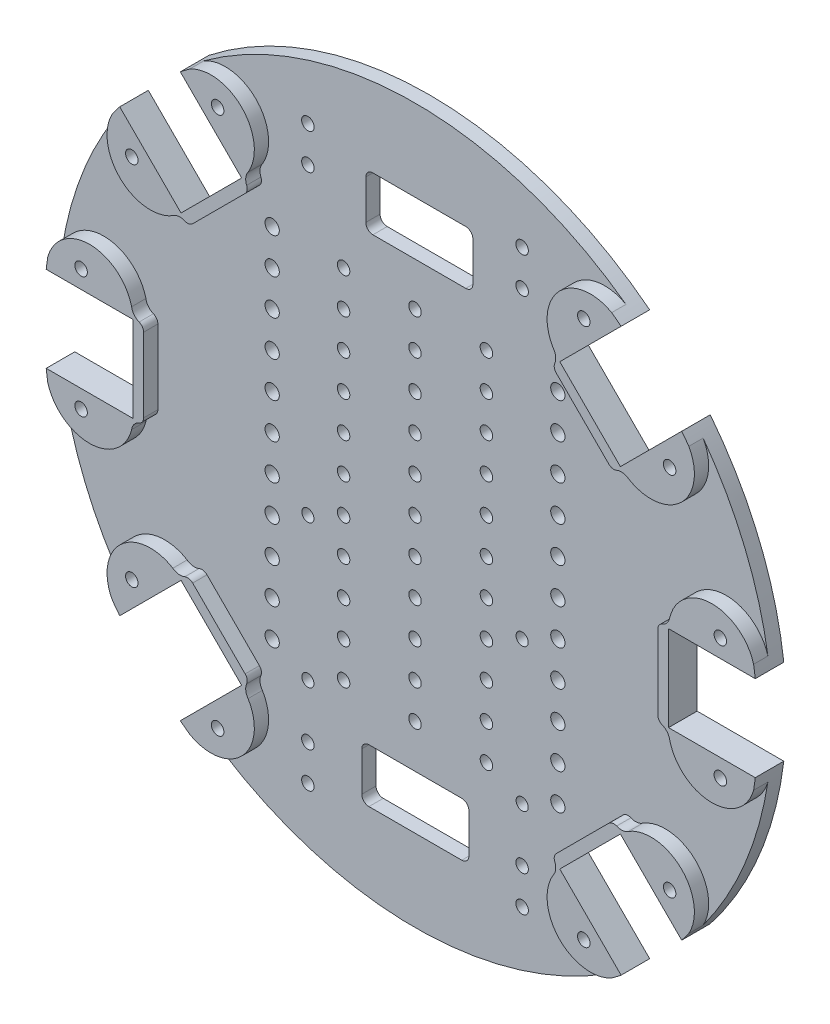
from build123d import *

# Parameters (mm, degrees)
SKETCH1_R           = 1.75
BOSS_EXTRUDE1_DEPTH = 4
SKETCH2_R           = 1.75
SKETCH2_R_2         = 2
SKETCH2_R_3         = 1.7
CUT_EXTRUDE1_DEPTH  = 10
SKETCH3_R           = 1.75
BOSS_EXTRUDE2_DEPTH = 4
CUT_EXTRUDE2_DEPTH  = 10


with BuildPart() as part:
    # Sketch1 → Boss-Extrude1 (new body)
    with BuildSketch(Plane.XY):
        with BuildLine():
            Line((61.518289963, 44.547727215), (44.547727215, 61.518289963))
            Line((44.547727215, 61.518289963), (61.714433725, 78.684996473))
            ThreePointArc((61.714433725, 78.684996473), (0, 100), (-61.714433725, 78.684996473))
            Line((-61.714433725, 78.684996473), (-44.547727215, 61.518289963))
            Line((-44.547727215, 61.518289963), (-61.518289963, 44.547727215))
            Line((-61.518289963, 44.547727215), (-78.684996473, 61.714433725))
            ThreePointArc((-78.684996473, 61.714433725), (-92.387953251, 38.268343237), (-99.277389168, 12))
            Line((-99.277389168, 12), (-75, 12))
            Line((-75, 12), (-75, -12))
            Line((-75, -12), (-99.277389168, -12))
            ThreePointArc((-99.277389168, -12), (-92.387953251, -38.268343237), (-78.684996473, -61.714433725))
            Line((-78.684996473, -61.714433725), (-61.518289963, -44.547727215))
            Line((-61.518289963, -44.547727215), (-44.547727215, -61.518289963))
            Line((-44.547727215, -61.518289963), (-61.714433725, -78.684996473))
            ThreePointArc((-61.714433725, -78.684996473), (0, -100), (61.714433725, -78.684996473))
            Line((61.714433725, -78.684996473), (44.547727215, -61.518289963))
            Line((44.547727215, -61.518289963), (61.518289963, -44.547727215))
            Line((61.518289963, -44.547727215), (78.684996473, -61.714433725))
            ThreePointArc((78.684996473, -61.714433725), (92.387953251, -38.268343237), (99.277389168, -12))
            Line((99.277389168, -12), (75, -12))
            Line((75, -12), (75, 12))
            Line((75, 12), (99.277389168, 12))
            ThreePointArc((99.277389168, 12), (92.387953251, 38.268343237), (78.684996473, 61.714433725))
            Line((78.684996473, 61.714433725), (61.518289963, 44.547727215))
        make_face()
        with Locations((-51.265241636, -75.306872196)):
            Circle(SKETCH1_R, mode=Mode.SUBTRACT)
        with Locations((-75.306872196, -51.265241636)):
            Circle(SKETCH1_R, mode=Mode.SUBTRACT)
        with Locations((-89.5, -17)):
            Circle(SKETCH1_R, mode=Mode.SUBTRACT)
        with Locations((51.265241636, -75.306872196)):
            Circle(SKETCH1_R, mode=Mode.SUBTRACT)
        with Locations((75.306872196, -51.265241636)):
            Circle(SKETCH1_R, mode=Mode.SUBTRACT)
        with Locations((89.5, -17)):
            Circle(SKETCH1_R, mode=Mode.SUBTRACT)
        with Locations((-89.5, 17)):
            Circle(SKETCH1_R, mode=Mode.SUBTRACT)
        with Locations((-75.306872196, 51.265241636)):
            Circle(SKETCH1_R, mode=Mode.SUBTRACT)
        with Locations((-51.265241636, 75.306872196)):
            Circle(SKETCH1_R, mode=Mode.SUBTRACT)
        with Locations((89.5, 17)):
            Circle(SKETCH1_R, mode=Mode.SUBTRACT)
        with Locations((75.306872196, 51.265241636)):
            Circle(SKETCH1_R, mode=Mode.SUBTRACT)
        with Locations((51.265241636, 75.306872196)):
            Circle(SKETCH1_R, mode=Mode.SUBTRACT)
    extrude(amount=BOSS_EXTRUDE1_DEPTH)

    # Sketch2 → Cut-Extrude1 (cut)
    with BuildSketch(Plane.XY.offset(4)):
        with Locations((0, 40)):
            Circle(SKETCH2_R)
        with Locations((-40, 40)):
            Circle(SKETCH2_R_2)
        with Locations((-20, 40)):
            Circle(SKETCH2_R)
        with Locations((-40, 50)):
            Circle(SKETCH2_R_2)
        with Locations((-20, 50)):
            Circle(SKETCH2_R)
        with Locations((-30, 70)):
            Circle(SKETCH2_R)
        with Locations((-30, 80)):
            Circle(SKETCH2_R)
        with Locations((30, 80)):
            Circle(SKETCH2_R)
        with Locations((30, 70)):
            Circle(SKETCH2_R)
        with Locations((40, 50)):
            Circle(SKETCH2_R_2)
        with Locations((20, 50)):
            Circle(SKETCH2_R)
        with Locations((0, 50)):
            Circle(SKETCH2_R)
        with Locations((40, 40)):
            Circle(SKETCH2_R_2)
        with Locations((20, 40)):
            Circle(SKETCH2_R)
        with Locations((30, -80)):
            Circle(SKETCH2_R)
        with Locations((-30, -80)):
            Circle(SKETCH2_R)
        with Locations((30, -70)):
            Circle(SKETCH2_R)
        with Locations((-30, -70)):
            Circle(SKETCH2_R)
        with Locations((0, 10)):
            Circle(SKETCH2_R)
        with Locations((-40, 10)):
            Circle(SKETCH2_R_2)
        with Locations((-20, 10)):
            Circle(SKETCH2_R)
        with Locations((40, 10)):
            Circle(SKETCH2_R_2)
        with Locations((20, 10)):
            Circle(SKETCH2_R)
        with Locations((0, 20)):
            Circle(SKETCH2_R)
        with Locations((-40, 20)):
            Circle(SKETCH2_R_2)
        with Locations((-20, 20)):
            Circle(SKETCH2_R)
        with Locations((40, 20)):
            Circle(SKETCH2_R_2)
        with Locations((20, 20)):
            Circle(SKETCH2_R)
        with Locations((0, 30)):
            Circle(SKETCH2_R)
        with Locations((-40, 30)):
            Circle(SKETCH2_R_2)
        with Locations((-20, 30)):
            Circle(SKETCH2_R)
        with Locations((40, 30)):
            Circle(SKETCH2_R_2)
        with Locations((20, 30)):
            Circle(SKETCH2_R)
        with Locations((0, -10)):
            Circle(SKETCH2_R)
        with Locations((40, -10)):
            Circle(SKETCH2_R_2)
        with Locations((20, -10)):
            Circle(SKETCH2_R)
        with Locations((-40, -10)):
            Circle(SKETCH2_R_2)
        with Locations((-20, -10)):
            Circle(SKETCH2_R)
        with Locations((0, -20)):
            Circle(SKETCH2_R)
        with Locations((40, -20)):
            Circle(SKETCH2_R_2)
        with Locations((20, -20)):
            Circle(SKETCH2_R)
        with Locations((-40, -20)):
            Circle(SKETCH2_R_2)
        with Locations((-20, -20)):
            Circle(SKETCH2_R)
        with Locations((0, -30)):
            Circle(SKETCH2_R)
        with Locations((40, -30)):
            Circle(SKETCH2_R_2)
        with Locations((20, -30)):
            Circle(SKETCH2_R)
        with Locations((-40, -30)):
            Circle(SKETCH2_R_2)
        with Locations((-20, -30)):
            Circle(SKETCH2_R)
        with Locations((0, -40)):
            Circle(SKETCH2_R)
        with Locations((40, -40)):
            Circle(SKETCH2_R_2)
        with Locations((20, -40)):
            Circle(SKETCH2_R)
        with Locations((-40, -40)):
            Circle(SKETCH2_R_2)
        with Locations((-20, -40)):
            Circle(SKETCH2_R)
        with Locations((0, -50)):
            Circle(SKETCH2_R)
        with Locations((40, -50)):
            Circle(SKETCH2_R_2)
        with Locations((20, -50)):
            Circle(SKETCH2_R)
        with Locations((-40, -50)):
            Circle(SKETCH2_R_2)
        with Locations((-20, -50)):
            Circle(SKETCH2_R)
        with Locations((-30, -55)):
            Circle(SKETCH2_R_3)
        with Locations((-30, -15)):
            Circle(SKETCH2_R_3)
        with Locations((30, -55)):
            Circle(SKETCH2_R_3)
        with Locations((30, -15)):
            Circle(SKETCH2_R_3)
        with Locations((-40, 0)):
            Circle(SKETCH2_R_2)
        with Locations((-20, 0)):
            Circle(SKETCH2_R)
        Circle(SKETCH2_R)
        with Locations((40, 0)):
            Circle(SKETCH2_R_2)
        with Locations((20, 0)):
            Circle(SKETCH2_R)
    extrude(amount=-CUT_EXTRUDE1_DEPTH, mode=Mode.SUBTRACT)

    # Sketch3 → Boss-Extrude2 (add)
    # profile 1 of 19: a face of its own
    with BuildSketch(Plane.XY.offset(4)):
        with BuildLine():
            ThreePointArc((42.745208303, -63.818207412), (44.40985161, -78.544869697), (59.074881311, -80.685552598))
            ThreePointArc((59.074881311, -80.685552598), (60.402940433, -79.696203091), (61.714433725, -78.684996473))
            Line((61.714433725, -78.684996473), (44.547727215, -61.518289963))
            ThreePointArc((44.547727215, -61.518289963), (43.738044879, -62.41276888), (43.021158129, -63.383207651))
            ThreePointArc((43.021158129, -63.383207651), (42.89146595, -63.605961831), (42.745208303, -63.818207412))
        make_face()
        with Locations((51.265241636, -75.306872196)):
            Circle(SKETCH3_R, mode=Mode.SUBTRACT)
    # profile 2 of 19: a face of its own
    with BuildSketch(Plane.XY.offset(4)):
        with BuildLine():
            ThreePointArc((43.021158129, -63.383207651), (43.738044879, -62.41276888), (44.547727215, -61.518289963))
            Line((44.547727215, -61.518289963), (61.518289963, -44.547727215))
            ThreePointArc((61.518289963, -44.547727215), (62.41276888, -43.738044879), (63.383207651, -43.021158129))
            ThreePointArc((63.383207651, -43.021158129), (61.934255267, -43.415364041), (60.457290906, -43.144370333))
            ThreePointArc((60.457290906, -43.144370333), (59.291136488, -43.01863263), (58.255022397, -43.568354094))
            Line((58.255022397, -43.568354094), (43.568354094, -58.255022397))
            ThreePointArc((43.568354094, -58.255022397), (43.01863263, -59.291136488), (43.144370333, -60.457290906))
            ThreePointArc((43.144370333, -60.457290906), (43.415364041, -61.934255267), (43.021158129, -63.383207651))
        make_face()
    # profile 3 of 19: a face of its own
    with BuildSketch(Plane.XY.offset(4)):
        with BuildLine():
            ThreePointArc((78.684996473, -61.714433725), (79.696203091, -60.402940433), (80.685552598, -59.074881311))
            ThreePointArc((80.685552598, -59.074881311), (78.544869697, -44.40985161), (63.818207412, -42.745208303))
            ThreePointArc((63.818207412, -42.745208303), (63.605961831, -42.89146595), (63.383207651, -43.021158129))
            ThreePointArc((63.383207651, -43.021158129), (62.41276888, -43.738044879), (61.518289963, -44.547727215))
            Line((61.518289963, -44.547727215), (78.684996473, -61.714433725))
        make_face()
        with Locations((75.306872196, -51.265241636)):
            Circle(SKETCH3_R, mode=Mode.SUBTRACT)
    # profile 4 of 19: a face of its own
    with BuildSketch(Plane.XY.offset(4)):
        with BuildLine():
            Line((99.277389168, -12), (75, -12))
            ThreePointArc((75, -12), (75.059960237, -13.205023978), (75.239248591, -14.398143296))
            ThreePointArc((75.239248591, -14.398143296), (75.305053363, -14.647360506), (75.351713878, -14.90086057))
            ThreePointArc((75.351713878, -14.90086057), (86.942117215, -24.137102766), (98.825550559, -15.281052213))
            ThreePointArc((98.825550559, -15.281052213), (99.065054424, -13.642396857), (99.277389168, -12))
        make_face()
        with Locations((89.5, -17)):
            Circle(SKETCH3_R, mode=Mode.SUBTRACT)
    # profile 5 of 19: a face of its own
    with BuildSketch(Plane.XY.offset(4)):
        with BuildLine():
            Line((75, -12), (75, 12))
            ThreePointArc((75, 12), (75.059960237, 13.205023978), (75.239248591, 14.398143296))
            ThreePointArc((75.239248591, 14.398143296), (74.493430208, 13.094833565), (73.257437204, 12.242083539))
            ThreePointArc((73.257437204, 12.242083539), (72.343931524, 11.506397825), (72, 10.38504275))
            Line((72, 10.38504275), (72, -10.38504275))
            ThreePointArc((72, -10.38504275), (72.343931524, -11.506397825), (73.257437204, -12.242083539))
            ThreePointArc((73.257437204, -12.242083539), (74.493430208, -13.094833565), (75.239248591, -14.398143296))
            ThreePointArc((75.239248591, -14.398143296), (75.059960237, -13.205023978), (75, -12))
        make_face()
    # profile 6 of 19: a face of its own
    with BuildSketch(Plane.XY.offset(4)):
        with BuildLine():
            ThreePointArc((99.277389168, 12), (99.065054424, 13.642396857), (98.825550559, 15.281052213))
            ThreePointArc((98.825550559, 15.281052213), (86.942117215, 24.137102766), (75.351713878, 14.90086057))
            ThreePointArc((75.351713878, 14.90086057), (75.305053363, 14.647360506), (75.239248591, 14.398143296))
            ThreePointArc((75.239248591, 14.398143296), (75.059960237, 13.205023978), (75, 12))
            Line((75, 12), (99.277389168, 12))
        make_face()
        with Locations((89.5, 17)):
            Circle(SKETCH3_R, mode=Mode.SUBTRACT)
    # profile 7 of 19: a face of its own
    with BuildSketch(Plane.XY.offset(4)):
        with BuildLine():
            ThreePointArc((80.685552598, 59.074881311), (79.696203091, 60.402940433), (78.684996473, 61.714433725))
            Line((78.684996473, 61.714433725), (61.518289963, 44.547727215))
            ThreePointArc((61.518289963, 44.547727215), (62.41276888, 43.738044879), (63.383207651, 43.021158129))
            ThreePointArc((63.383207651, 43.021158129), (63.605961831, 42.89146595), (63.818207412, 42.745208303))
            ThreePointArc((63.818207412, 42.745208303), (78.544869697, 44.40985161), (80.685552598, 59.074881311))
        make_face()
        with Locations((75.306872196, 51.265241636)):
            Circle(SKETCH3_R, mode=Mode.SUBTRACT)
    # profile 8 of 19: a face of its own
    with BuildSketch(Plane.XY.offset(4)):
        with BuildLine():
            Line((61.518289963, 44.547727215), (44.547727215, 61.518289963))
            ThreePointArc((44.547727215, 61.518289963), (43.738044879, 62.41276888), (43.021158129, 63.383207651))
            ThreePointArc((43.021158129, 63.383207651), (43.415364041, 61.934255267), (43.144370333, 60.457290906))
            ThreePointArc((43.144370333, 60.457290906), (43.01863263, 59.291136488), (43.568354094, 58.255022397))
            Line((43.568354094, 58.255022397), (58.255022397, 43.568354094))
            ThreePointArc((58.255022397, 43.568354094), (59.291136488, 43.01863263), (60.457290906, 43.144370333))
            ThreePointArc((60.457290906, 43.144370333), (61.934255267, 43.415364041), (63.383207651, 43.021158129))
            ThreePointArc((63.383207651, 43.021158129), (62.41276888, 43.738044879), (61.518289963, 44.547727215))
        make_face()
    # profile 9 of 19: a face of its own
    with BuildSketch(Plane.XY.offset(4)):
        with BuildLine():
            ThreePointArc((61.714433725, 78.684996473), (60.402940433, 79.696203091), (59.074881311, 80.685552598))
            ThreePointArc((59.074881311, 80.685552598), (44.40985161, 78.544869697), (42.745208303, 63.818207412))
            ThreePointArc((42.745208303, 63.818207412), (42.89146595, 63.605961831), (43.021158129, 63.383207651))
            ThreePointArc((43.021158129, 63.383207651), (43.738044879, 62.41276888), (44.547727215, 61.518289963))
            Line((44.547727215, 61.518289963), (61.714433725, 78.684996473))
        make_face()
        with Locations((51.265241636, 75.306872196)):
            Circle(SKETCH3_R, mode=Mode.SUBTRACT)
    # profile 10 of 19: a face of its own
    with BuildSketch(Plane.XY.offset(4)):
        with BuildLine():
            ThreePointArc((-59.074881311, 80.685552598), (-60.402940433, 79.696203091), (-61.714433725, 78.684996473))
            Line((-61.714433725, 78.684996473), (-44.547727215, 61.518289963))
            ThreePointArc((-44.547727215, 61.518289963), (-43.738044879, 62.41276888), (-43.021158129, 63.383207651))
            ThreePointArc((-43.021158129, 63.383207651), (-42.89146595, 63.605961831), (-42.745208303, 63.818207412))
            ThreePointArc((-42.745208303, 63.818207412), (-44.40985161, 78.544869697), (-59.074881311, 80.685552598))
        make_face()
        with Locations((-51.265241636, 75.306872196)):
            Circle(SKETCH3_R, mode=Mode.SUBTRACT)
    # profile 11 of 19: a face of its own
    with BuildSketch(Plane.XY.offset(4)):
        with BuildLine():
            Line((-44.547727215, 61.518289963), (-53.033008589, 53.033008589))
            Line((-53.033008589, 53.033008589), (-50.911688245, 50.911688245))
            Line((-50.911688245, 50.911688245), (-43.568354094, 58.255022397))
            ThreePointArc((-43.568354094, 58.255022397), (-43.01863263, 59.291136488), (-43.144370333, 60.457290906))
            ThreePointArc((-43.144370333, 60.457290906), (-43.415364041, 61.934255267), (-43.021158129, 63.383207651))
            ThreePointArc((-43.021158129, 63.383207651), (-43.738044879, 62.41276888), (-44.547727215, 61.518289963))
        make_face()
    # profile 12 of 19: a face of its own
    with BuildSketch(Plane.XY.offset(4)):
        with BuildLine():
            Line((-53.033008589, 53.033008589), (-61.518289963, 44.547727215))
            ThreePointArc((-61.518289963, 44.547727215), (-62.41276888, 43.738044879), (-63.383207651, 43.021158129))
            ThreePointArc((-63.383207651, 43.021158129), (-61.934255267, 43.415364041), (-60.457290906, 43.144370333))
            ThreePointArc((-60.457290906, 43.144370333), (-59.291136488, 43.01863263), (-58.255022397, 43.568354094))
            Line((-58.255022397, 43.568354094), (-50.911688245, 50.911688245))
            Line((-50.911688245, 50.911688245), (-53.033008589, 53.033008589))
        make_face()
    # profile 13 of 19: a face of its own
    with BuildSketch(Plane.XY.offset(4)):
        with BuildLine():
            Line((-61.518289963, 44.547727215), (-78.684996473, 61.714433725))
            ThreePointArc((-78.684996473, 61.714433725), (-79.696203091, 60.402940433), (-80.685552598, 59.074881311))
            ThreePointArc((-80.685552598, 59.074881311), (-78.544869697, 44.40985161), (-63.818207412, 42.745208303))
            ThreePointArc((-63.818207412, 42.745208303), (-63.605961831, 42.89146595), (-63.383207651, 43.021158129))
            ThreePointArc((-63.383207651, 43.021158129), (-62.41276888, 43.738044879), (-61.518289963, 44.547727215))
        make_face()
        with Locations((-75.306872196, 51.265241636)):
            Circle(SKETCH3_R, mode=Mode.SUBTRACT)
    # profile 14 of 19: a face of its own
    with BuildSketch(Plane.XY.offset(4)):
        with BuildLine():
            ThreePointArc((-75.351713878, 14.90086057), (-86.942117215, 24.137102766), (-98.825550559, 15.281052213))
            ThreePointArc((-98.825550559, 15.281052213), (-99.065054424, 13.642396857), (-99.277389168, 12))
            Line((-99.277389168, 12), (-75, 12))
            ThreePointArc((-75, 12), (-75.059960237, 13.205023978), (-75.239248591, 14.398143296))
            ThreePointArc((-75.239248591, 14.398143296), (-75.305053363, 14.647360506), (-75.351713878, 14.90086057))
        make_face()
        with Locations((-89.5, 17)):
            Circle(SKETCH3_R, mode=Mode.SUBTRACT)
    # profile 15 of 19: a face of its own
    with BuildSketch(Plane.XY.offset(4)):
        with BuildLine():
            ThreePointArc((-75.239248591, 14.398143296), (-75.059960237, 13.205023978), (-75, 12))
            Line((-75, 12), (-75, -12))
            ThreePointArc((-75, -12), (-75.059960237, -13.205023978), (-75.239248591, -14.398143296))
            ThreePointArc((-75.239248591, -14.398143296), (-74.493430208, -13.094833565), (-73.257437204, -12.242083539))
            ThreePointArc((-73.257437204, -12.242083539), (-72.343931524, -11.506397825), (-72, -10.38504275))
            Line((-72, -10.38504275), (-72, 10.38504275))
            ThreePointArc((-72, 10.38504275), (-72.343931524, 11.506397825), (-73.257437204, 12.242083539))
            ThreePointArc((-73.257437204, 12.242083539), (-74.493430208, 13.094833565), (-75.239248591, 14.398143296))
        make_face()
    # profile 16 of 19: a face of its own
    with BuildSketch(Plane.XY.offset(4)):
        with BuildLine():
            Line((-75, -12), (-99.277389168, -12))
            ThreePointArc((-99.277389168, -12), (-99.065054424, -13.642396857), (-98.825550559, -15.281052213))
            ThreePointArc((-98.825550559, -15.281052213), (-86.942117215, -24.137102766), (-75.351713878, -14.90086057))
            ThreePointArc((-75.351713878, -14.90086057), (-75.305053363, -14.647360506), (-75.239248591, -14.398143296))
            ThreePointArc((-75.239248591, -14.398143296), (-75.059960237, -13.205023978), (-75, -12))
        make_face()
        with Locations((-89.5, -17)):
            Circle(SKETCH3_R, mode=Mode.SUBTRACT)
    # profile 17 of 19: a face of its own
    with BuildSketch(Plane.XY.offset(4)):
        with BuildLine():
            ThreePointArc((-63.818207412, -42.745208303), (-78.544869697, -44.40985161), (-80.685552598, -59.074881311))
            ThreePointArc((-80.685552598, -59.074881311), (-79.696203091, -60.402940433), (-78.684996473, -61.714433725))
            Line((-78.684996473, -61.714433725), (-61.518289963, -44.547727215))
            ThreePointArc((-61.518289963, -44.547727215), (-62.41276888, -43.738044879), (-63.383207651, -43.021158129))
            ThreePointArc((-63.383207651, -43.021158129), (-63.605961831, -42.89146595), (-63.818207412, -42.745208303))
        make_face()
        with Locations((-75.306872196, -51.265241636)):
            Circle(SKETCH3_R, mode=Mode.SUBTRACT)
    # profile 18 of 19: a face of its own
    with BuildSketch(Plane.XY.offset(4)):
        with BuildLine():
            ThreePointArc((-63.383207651, -43.021158129), (-62.41276888, -43.738044879), (-61.518289963, -44.547727215))
            Line((-61.518289963, -44.547727215), (-44.547727215, -61.518289963))
            ThreePointArc((-44.547727215, -61.518289963), (-43.738044879, -62.41276888), (-43.021158129, -63.383207651))
            ThreePointArc((-43.021158129, -63.383207651), (-43.415364041, -61.934255267), (-43.144370333, -60.457290906))
            ThreePointArc((-43.144370333, -60.457290906), (-43.01863263, -59.291136488), (-43.568354094, -58.255022397))
            Line((-43.568354094, -58.255022397), (-58.255022397, -43.568354094))
            ThreePointArc((-58.255022397, -43.568354094), (-59.291136488, -43.01863263), (-60.457290906, -43.144370333))
            ThreePointArc((-60.457290906, -43.144370333), (-61.934255267, -43.415364041), (-63.383207651, -43.021158129))
        make_face()
    # profile 19 of 19: a face of its own
    with BuildSketch(Plane.XY.offset(4)):
        with BuildLine():
            Line((-44.547727215, -61.518289963), (-61.714433725, -78.684996473))
            ThreePointArc((-61.714433725, -78.684996473), (-60.402940433, -79.696203091), (-59.074881311, -80.685552598))
            ThreePointArc((-59.074881311, -80.685552598), (-44.40985161, -78.544869697), (-42.745208303, -63.818207412))
            ThreePointArc((-42.745208303, -63.818207412), (-42.89146595, -63.605961831), (-43.021158129, -63.383207651))
            ThreePointArc((-43.021158129, -63.383207651), (-43.738044879, -62.41276888), (-44.547727215, -61.518289963))
        make_face()
        with Locations((-51.265241636, -75.306872196)):
            Circle(SKETCH3_R, mode=Mode.SUBTRACT)
    extrude(amount=BOSS_EXTRUDE2_DEPTH)

    # Sketch4 → Cut-Extrude2 (cut)
    with BuildSketch(Plane.XY.offset(4)):
        with BuildLine():
            Line((13.099983645, -77.099672773), (-12.900016355, -77.099672773))
            ThreePointArc((-12.900016355, -77.099672773), (-14.314229917, -76.513886336), (-14.900016355, -75.099672773))
            Line((-14.900016355, -75.099672773), (-14.900016355, -64.099672773))
            ThreePointArc((-14.900016355, -64.099672773), (-14.314229917, -62.685459211), (-12.900016355, -62.099672773))
            Line((-12.900016355, -62.099672773), (13.099983645, -62.099672773))
            ThreePointArc((13.099983645, -62.099672773), (14.514197207, -62.685459211), (15.099983645, -64.099672773))
            Line((15.099983645, -64.099672773), (15.099983645, -75.099672773))
            ThreePointArc((15.099983645, -75.099672773), (14.514197207, -76.513886336), (13.099983645, -77.099672773))
        make_face()
        with BuildLine():
            Line((14.211764519, 62.127309363), (-11.788235481, 62.127309363))
            ThreePointArc((-11.788235481, 62.127309363), (-13.202449044, 62.713095801), (-13.788235481, 64.127309363))
            Line((-13.788235481, 64.127309363), (-13.788235481, 75.127309363))
            ThreePointArc((-13.788235481, 75.127309363), (-13.202449044, 76.541522925), (-11.788235481, 77.127309363))
            Line((-11.788235481, 77.127309363), (14.211764519, 77.127309363))
            ThreePointArc((14.211764519, 77.127309363), (15.625978081, 76.541522925), (16.211764519, 75.127309363))
            Line((16.211764519, 75.127309363), (16.211764519, 64.127309363))
            ThreePointArc((16.211764519, 64.127309363), (15.625978081, 62.713095801), (14.211764519, 62.127309363))
        make_face()
    extrude(amount=-CUT_EXTRUDE2_DEPTH, mode=Mode.SUBTRACT)


solid = part.part
